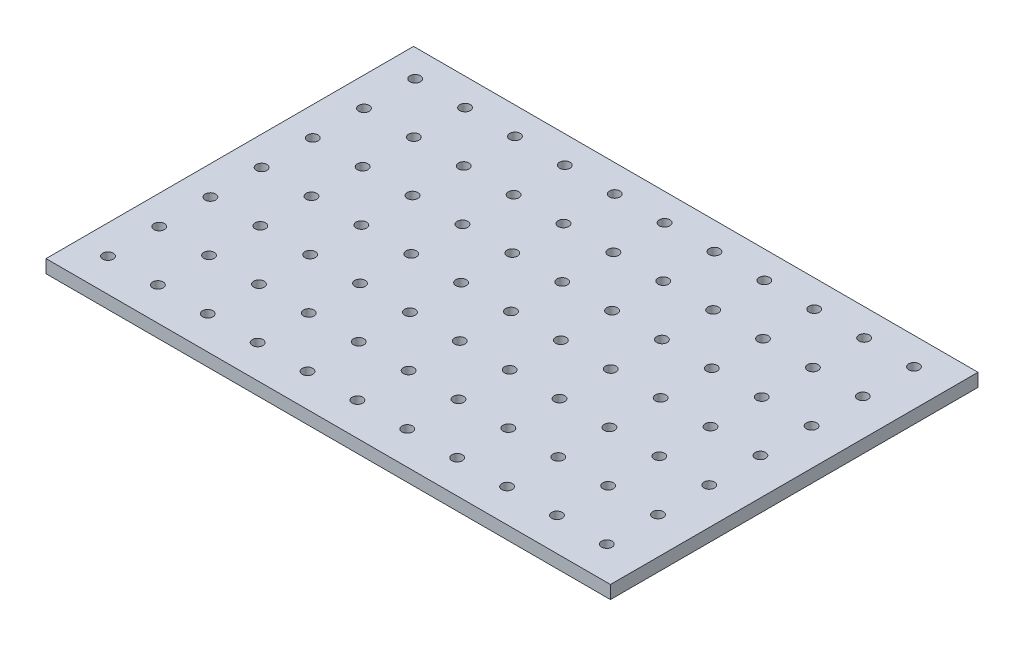
from build123d import *

# Parameters (mm, degrees)
SKETCH1_W           = 215
SKETCH1_H           = 140
BOSS_EXTRUDE1_DEPTH = 5
SKETCH2_R           = 2
CUT_EXTRUDE1_DEPTH  = 5


with BuildPart() as part:
    # Sketch1 → Boss-Extrude1 (new body)
    with BuildSketch(Plane(origin=(0, 0, 0), x_dir=(1, 0, 0), z_dir=(0, 1, 0))):
        with Locations((45.534682081, -24.335260116)):
            Rectangle(SKETCH1_W, SKETCH1_H)
    extrude(amount=BOSS_EXTRUDE1_DEPTH)

    # Sketch2 → Cut-Extrude1 (cut)
    with BuildSketch(Plane(origin=(0, 5, 0), x_dir=(1, 0, 0), z_dir=(0, 1, 0))):
        with Locations(Location((-50.965317919, 35.27894491, 0), (0, 0, 270))):
            Circle(SKETCH2_R)
        with Locations(Location((-31.965317919, 35.27894491, 0), (0, 0, 270))):
            Circle(SKETCH2_R)
        with Locations(Location((-12.965317919, 35.27894491, 0), (0, 0, 270))):
            Circle(SKETCH2_R)
        with Locations(Location((6.034682081, 35.27894491, 0), (0, 0, 270))):
            Circle(SKETCH2_R)
        with Locations(Location((25.034682081, 35.27894491, 0), (0, 0, 270))):
            Circle(SKETCH2_R)
        with Locations(Location((44.034682081, 35.27894491, 0), (0, 0, 270))):
            Circle(SKETCH2_R)
        with Locations(Location((63.034682081, 35.27894491, 0), (0, 0, 270))):
            Circle(SKETCH2_R)
        with Locations(Location((82.034682081, 35.27894491, 0), (0, 0, 270))):
            Circle(SKETCH2_R)
        with Locations(Location((101.034682081, 35.27894491, 0), (0, 0, 270))):
            Circle(SKETCH2_R)
        with Locations(Location((120.034682081, 35.27894491, 0), (0, 0, 270))):
            Circle(SKETCH2_R)
        with Locations(Location((139.034682081, 35.27894491, 0), (0, 0, 270))):
            Circle(SKETCH2_R)
        with Locations(Location((-50.965317919, 15.77894491, 0), (0, 0, 270))):
            Circle(SKETCH2_R)
        with Locations(Location((-31.965317919, 15.77894491, 0), (0, 0, 270))):
            Circle(SKETCH2_R)
        with Locations(Location((-12.965317919, 15.77894491, 0), (0, 0, 270))):
            Circle(SKETCH2_R)
        with Locations(Location((6.034682081, 15.77894491, 0), (0, 0, 270))):
            Circle(SKETCH2_R)
        with Locations(Location((25.034682081, 15.77894491, 0), (0, 0, 270))):
            Circle(SKETCH2_R)
        with Locations(Location((44.034682081, 15.77894491, 0), (0, 0, 270))):
            Circle(SKETCH2_R)
        with Locations(Location((63.034682081, 15.77894491, 0), (0, 0, 270))):
            Circle(SKETCH2_R)
        with Locations(Location((82.034682081, 15.77894491, 0), (0, 0, 270))):
            Circle(SKETCH2_R)
        with Locations(Location((101.034682081, 15.77894491, 0), (0, 0, 270))):
            Circle(SKETCH2_R)
        with Locations(Location((120.034682081, 15.77894491, 0), (0, 0, 270))):
            Circle(SKETCH2_R)
        with Locations(Location((139.034682081, 15.77894491, 0), (0, 0, 270))):
            Circle(SKETCH2_R)
        with Locations(Location((-50.965317919, -3.72105509, 0), (0, 0, 270))):
            Circle(SKETCH2_R)
        with Locations(Location((-31.965317919, -3.72105509, 0), (0, 0, 270))):
            Circle(SKETCH2_R)
        with Locations(Location((-12.965317919, -3.72105509, 0), (0, 0, 270))):
            Circle(SKETCH2_R)
        with Locations(Location((6.034682081, -3.72105509, 0), (0, 0, 270))):
            Circle(SKETCH2_R)
        with Locations(Location((25.034682081, -3.72105509, 0), (0, 0, 270))):
            Circle(SKETCH2_R)
        with Locations(Location((44.034682081, -3.72105509, 0), (0, 0, 270))):
            Circle(SKETCH2_R)
        with Locations(Location((63.034682081, -3.72105509, 0), (0, 0, 270))):
            Circle(SKETCH2_R)
        with Locations(Location((82.034682081, -3.72105509, 0), (0, 0, 270))):
            Circle(SKETCH2_R)
        with Locations(Location((101.034682081, -3.72105509, 0), (0, 0, 270))):
            Circle(SKETCH2_R)
        with Locations(Location((120.034682081, -3.72105509, 0), (0, 0, 270))):
            Circle(SKETCH2_R)
        with Locations(Location((139.034682081, -3.72105509, 0), (0, 0, 270))):
            Circle(SKETCH2_R)
        with Locations(Location((-50.965317919, -23.22105509, 0), (0, 0, 270))):
            Circle(SKETCH2_R)
        with Locations(Location((-31.965317919, -23.22105509, 0), (0, 0, 270))):
            Circle(SKETCH2_R)
        with Locations(Location((-12.965317919, -23.22105509, 0), (0, 0, 270))):
            Circle(SKETCH2_R)
        with Locations(Location((6.034682081, -23.22105509, 0), (0, 0, 270))):
            Circle(SKETCH2_R)
        with Locations(Location((25.034682081, -23.22105509, 0), (0, 0, 270))):
            Circle(SKETCH2_R)
        with Locations(Location((44.034682081, -23.22105509, 0), (0, 0, 270))):
            Circle(SKETCH2_R)
        with Locations(Location((63.034682081, -23.22105509, 0), (0, 0, 270))):
            Circle(SKETCH2_R)
        with Locations(Location((82.034682081, -23.22105509, 0), (0, 0, 270))):
            Circle(SKETCH2_R)
        with Locations(Location((101.034682081, -23.22105509, 0), (0, 0, 270))):
            Circle(SKETCH2_R)
        with Locations(Location((120.034682081, -23.22105509, 0), (0, 0, 270))):
            Circle(SKETCH2_R)
        with Locations(Location((139.034682081, -23.22105509, 0), (0, 0, 270))):
            Circle(SKETCH2_R)
        with Locations(Location((-50.965317919, -42.72105509, 0), (0, 0, 270))):
            Circle(SKETCH2_R)
        with Locations(Location((-31.965317919, -42.72105509, 0), (0, 0, 270))):
            Circle(SKETCH2_R)
        with Locations(Location((-12.965317919, -42.72105509, 0), (0, 0, 270))):
            Circle(SKETCH2_R)
        with Locations(Location((6.034682081, -42.72105509, 0), (0, 0, 270))):
            Circle(SKETCH2_R)
        with Locations(Location((25.034682081, -42.72105509, 0), (0, 0, 270))):
            Circle(SKETCH2_R)
        with Locations(Location((44.034682081, -42.72105509, 0), (0, 0, 270))):
            Circle(SKETCH2_R)
        with Locations(Location((63.034682081, -42.72105509, 0), (0, 0, 270))):
            Circle(SKETCH2_R)
        with Locations(Location((82.034682081, -42.72105509, 0), (0, 0, 270))):
            Circle(SKETCH2_R)
        with Locations(Location((101.034682081, -42.72105509, 0), (0, 0, 270))):
            Circle(SKETCH2_R)
        with Locations(Location((120.034682081, -42.72105509, 0), (0, 0, 270))):
            Circle(SKETCH2_R)
        with Locations(Location((139.034682081, -42.72105509, 0), (0, 0, 270))):
            Circle(SKETCH2_R)
        with Locations(Location((-50.965317919, -62.22105509, 0), (0, 0, 270))):
            Circle(SKETCH2_R)
        with Locations(Location((-31.965317919, -62.22105509, 0), (0, 0, 270))):
            Circle(SKETCH2_R)
        with Locations(Location((-12.965317919, -62.22105509, 0), (0, 0, 270))):
            Circle(SKETCH2_R)
        with Locations(Location((6.034682081, -62.22105509, 0), (0, 0, 270))):
            Circle(SKETCH2_R)
        with Locations(Location((25.034682081, -62.22105509, 0), (0, 0, 270))):
            Circle(SKETCH2_R)
        with Locations(Location((44.034682081, -62.22105509, 0), (0, 0, 270))):
            Circle(SKETCH2_R)
        with Locations(Location((63.034682081, -62.22105509, 0), (0, 0, 270))):
            Circle(SKETCH2_R)
        with Locations(Location((82.034682081, -62.22105509, 0), (0, 0, 270))):
            Circle(SKETCH2_R)
        with Locations(Location((101.034682081, -62.22105509, 0), (0, 0, 270))):
            Circle(SKETCH2_R)
        with Locations(Location((120.034682081, -62.22105509, 0), (0, 0, 270))):
            Circle(SKETCH2_R)
        with Locations(Location((139.034682081, -62.22105509, 0), (0, 0, 270))):
            Circle(SKETCH2_R)
        with Locations(Location((-50.965317919, -81.72105509, 0), (0, 0, 270))):
            Circle(SKETCH2_R)
        with Locations(Location((-31.965317919, -81.72105509, 0), (0, 0, 270))):
            Circle(SKETCH2_R)
        with Locations(Location((-12.965317919, -81.72105509, 0), (0, 0, 270))):
            Circle(SKETCH2_R)
        with Locations(Location((6.034682081, -81.72105509, 0), (0, 0, 270))):
            Circle(SKETCH2_R)
        with Locations(Location((25.034682081, -81.72105509, 0), (0, 0, 270))):
            Circle(SKETCH2_R)
        with Locations(Location((44.034682081, -81.72105509, 0), (0, 0, 270))):
            Circle(SKETCH2_R)
        with Locations(Location((63.034682081, -81.72105509, 0), (0, 0, 270))):
            Circle(SKETCH2_R)
        with Locations(Location((82.034682081, -81.72105509, 0), (0, 0, 270))):
            Circle(SKETCH2_R)
        with Locations(Location((101.034682081, -81.72105509, 0), (0, 0, 270))):
            Circle(SKETCH2_R)
        with Locations(Location((120.034682081, -81.72105509, 0), (0, 0, 270))):
            Circle(SKETCH2_R)
        with Locations(Location((139.034682081, -81.72105509, 0), (0, 0, 270))):
            Circle(SKETCH2_R)
    extrude(amount=-CUT_EXTRUDE1_DEPTH, mode=Mode.SUBTRACT)


solid = part.part
